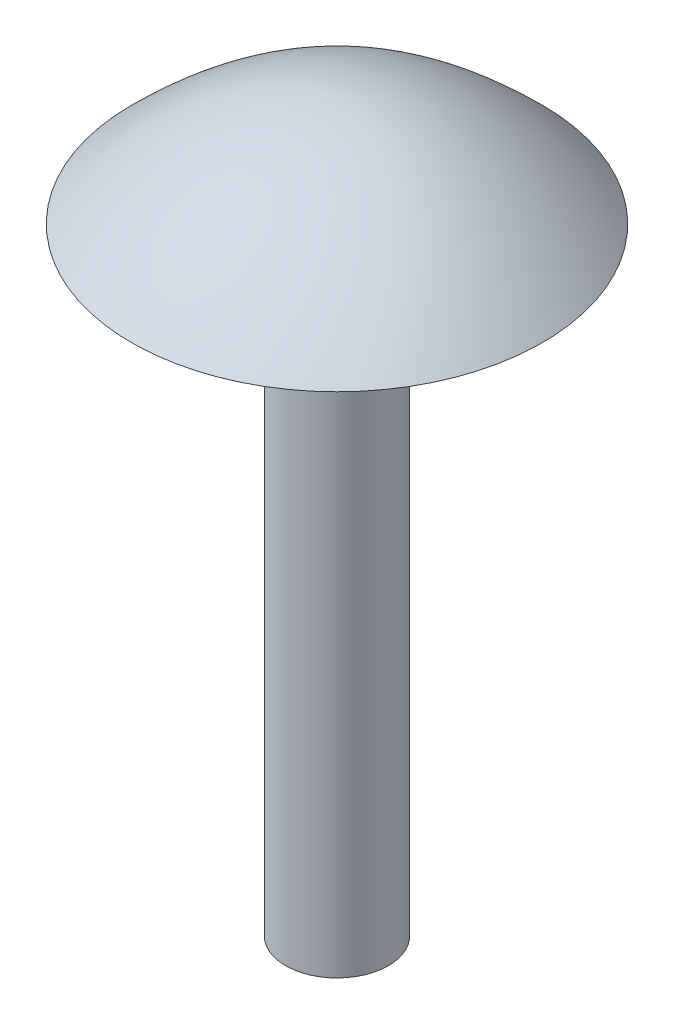
from build123d import *


with BuildPart() as part:
    # Sketch1 → Revolve1 (revolve)
    with BuildSketch(Plane.XY, mode=Mode.PRIVATE) as revolve1_sk:
        with BuildLine():
            Line((0, 0), (0, 6))
            Line((0, 6), (-1.5, 6))
            add(Edge.make_bspline(
                [(-1.5, 6), (-0.5, 7), (0.5, 7)],
                knots=[0, 0, 0, 0.5, 0.5, 0.5], degree=2))
            Line((0.5, 7), (0.5, 0))
            Line((0.5, 0), (0, 0))
        make_face()
    revolve(revolve1_sk.sketch.rotate(Axis((0.5, -1.404443636, 0), (0, 1, 0)), 270), axis=Axis((0.5, -1.404443636, 0), (0, 1, 0)))


solid = part.part
